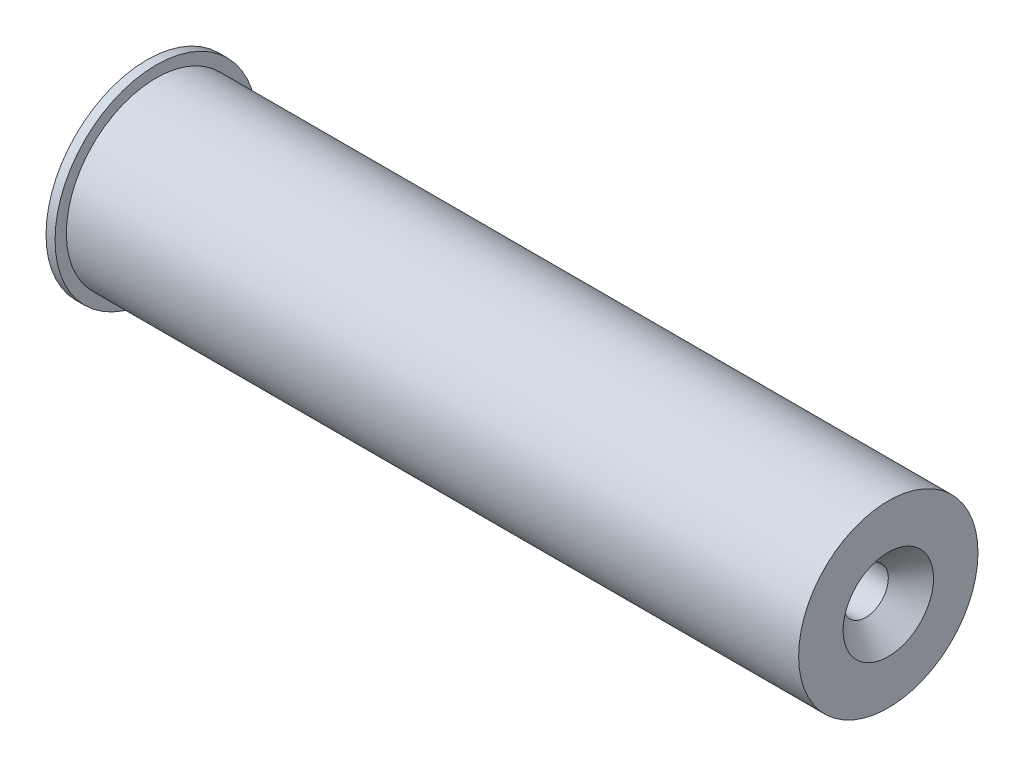
from build123d import *

# Parameters (mm, degrees)
SKETCH1_R           = 25.2
BOSS_EXTRUDE1_DEPTH = 208.28
SKETCH2_R           = 28.375
BOSS_EXTRUDE2_DEPTH = 2.54
SKETCH4_R           = 6.35
CUT_EXTRUDE1_DEPTH  = 213.110442105
CHAMFER1_SIZE       = 6.35


with BuildPart() as part:
    # Sketch1 → Boss-Extrude1 (new body)
    with BuildSketch(Plane(origin=(0, 0, 0), x_dir=(0, 0, -1), z_dir=(1, 0, 0))):
        Circle(SKETCH1_R)
    extrude(amount=BOSS_EXTRUDE1_DEPTH)

    # Sketch2 → Boss-Extrude2 (add)
    with BuildSketch(Plane.ZY):
        Circle(SKETCH2_R)
    extrude(amount=-BOSS_EXTRUDE2_DEPTH)

    # Sketch4 → Cut-Extrude1 (cut, through all)
    with BuildSketch(Plane(origin=(208.28, 0, 0), x_dir=(0, 0, -1), z_dir=(1, 0, 0))):
        Circle(SKETCH4_R)
    extrude(amount=-CUT_EXTRUDE1_DEPTH, mode=Mode.SUBTRACT)

    # Chamfer1
    chamfer1_edges = [part.edges().sort_by_distance(p)[0] for p in [
        (208.28, 0, 6.35),
    ]]
    chamfer(chamfer1_edges, length=CHAMFER1_SIZE)


solid = part.part
